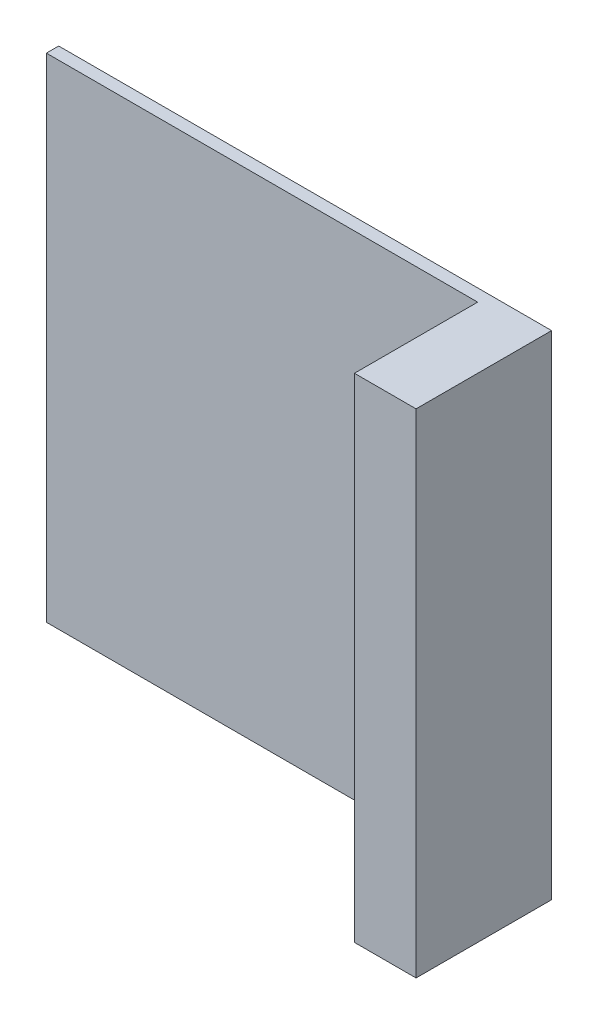
from build123d import *

# Parameters (mm, degrees)
SKETCH1_W           = 400
SKETCH1_H           = 400
BOSS_EXTRUDE1_DEPTH = 10
SKETCH2_W           = 50
SKETCH2_H           = 400
BOSS_EXTRUDE2_DEPTH = 100


with BuildPart() as part:
    # Sketch1 → Boss-Extrude1 (new body)
    with BuildSketch(Plane.XY):
        with Locations((131.052967286, 168.599704093)):
            Rectangle(SKETCH1_W, SKETCH1_H)
    extrude(amount=BOSS_EXTRUDE1_DEPTH)

    # Sketch2 → Boss-Extrude2 (add)
    with BuildSketch(Plane.XY.offset(10)):
        with Locations((306.052967286, 168.599704093)):
            Rectangle(SKETCH2_W, SKETCH2_H)
    extrude(amount=BOSS_EXTRUDE2_DEPTH)


solid = part.part
